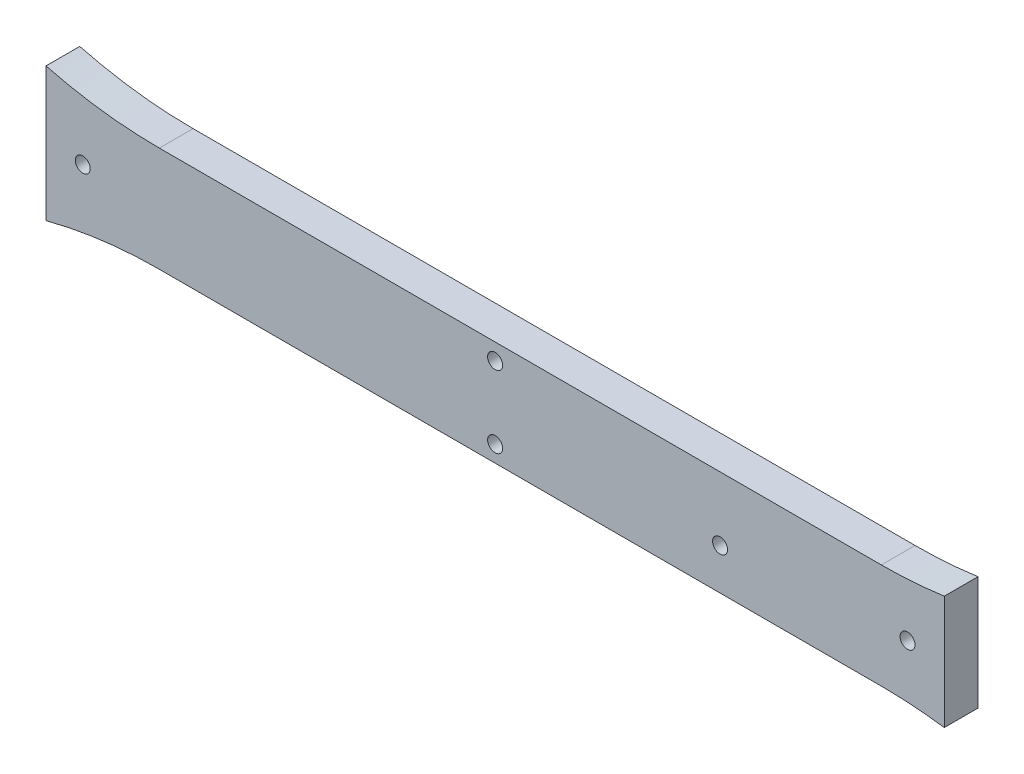
from build123d import *

# Parameters (mm, degrees)
SKETCH_1_W          = 119.8
SKETCH_1_H          = 14
SKETCH_1_R          = 1
EXTRUDE_1_DEPTH     = 4.5
SKETCH_2_R          = 1
CUT_EXTRUDE_1_DEPTH = 61.475284208
EXTRUDE_3_DEPTH     = 4.5
FILLET_2_R          = 60
SKETCH_4_W          = 35.836686159
SKETCH_4_H          = 36.800205236
SKETCH_4_W_2        = 36.792514639
SKETCH_4_H_2        = 45.403787019
CUT_EXTRUDE_3_DEPTH = 10


with BuildPart() as part:
    # 스케치1 → 보스-돌출1 (new body)
    with BuildSketch(Plane.XY):
        Rectangle(SKETCH_1_W, SKETCH_1_H)
        with Locations((55, 0)):
            Circle(SKETCH_1_R, mode=Mode.SUBTRACT)
        with Locations((-55, 0)):
            Circle(SKETCH_1_R, mode=Mode.SUBTRACT)
        with Locations((0, 4.8)):
            Circle(SKETCH_1_R, mode=Mode.SUBTRACT)
        with Locations((0, -4.8)):
            Circle(SKETCH_1_R, mode=Mode.SUBTRACT)
    extrude(amount=EXTRUDE_1_DEPTH)

    # 스케치2 → 컷-돌출1 (cut, through all)
    with BuildSketch(Plane(origin=(0, 0, 0), x_dir=(-1, 0, 0), z_dir=(0, 0, -1))):
        with Locations((-30, -1.5)):
            Circle(SKETCH_2_R)
    extrude(amount=-CUT_EXTRUDE_1_DEPTH, mode=Mode.SUBTRACT)

    # 스케치3 → 보스-돌출3 (add)
    with BuildSketch(Plane(origin=(0, 0, 0), x_dir=(-1, 0, 0), z_dir=(0, 0, -1))):
        with BuildLine():
            Line((-59.9, 7), (-66.514718626, 7))
            ThreePointArc((-66.514718626, 7), (-86, 0), (-66.514718626, -7))
            Line((-66.514718626, -7), (-59.9, -7))
            Line((-59.9, -7), (-59.9, 7))
        make_face()
        with BuildLine():
            Line((63.456603619, 7), (59.9, 7))
            Line((59.9, 7), (59.9, -7))
            Line((59.9, -7), (63.456603619, -7))
            ThreePointArc((63.456603619, -7), (88.5, 0), (63.456603619, 7))
        make_face()
    extrude(amount=-EXTRUDE_3_DEPTH)

    # 필렛2
    fillet_2_edges = [part.edges().sort_by_distance(p)[0] for p in [
        (66.514718626, -7, 2.25),
        (66.514718626, 7, 2.25),
        (-63.456603619, 7, 2.25),
        (-63.456603619, -7, 2.25),
    ]]
    fillet(fillet_2_edges, radius=FILLET_2_R)

    # 스케치4 → 컷-돌출3 (cut)
    with BuildSketch(Plane(origin=(0, 0, 0), x_dir=(-1, 0, 0), z_dir=(0, 0, -1))):
        with Locations((-77.81834308, 0.810947821)):
            Rectangle(SKETCH_4_W, SKETCH_4_H)
        with Locations((78.29625732, -1.687852432)):
            Rectangle(SKETCH_4_W_2, SKETCH_4_H_2)
    extrude(amount=-CUT_EXTRUDE_3_DEPTH, mode=Mode.SUBTRACT)


solid = part.part
